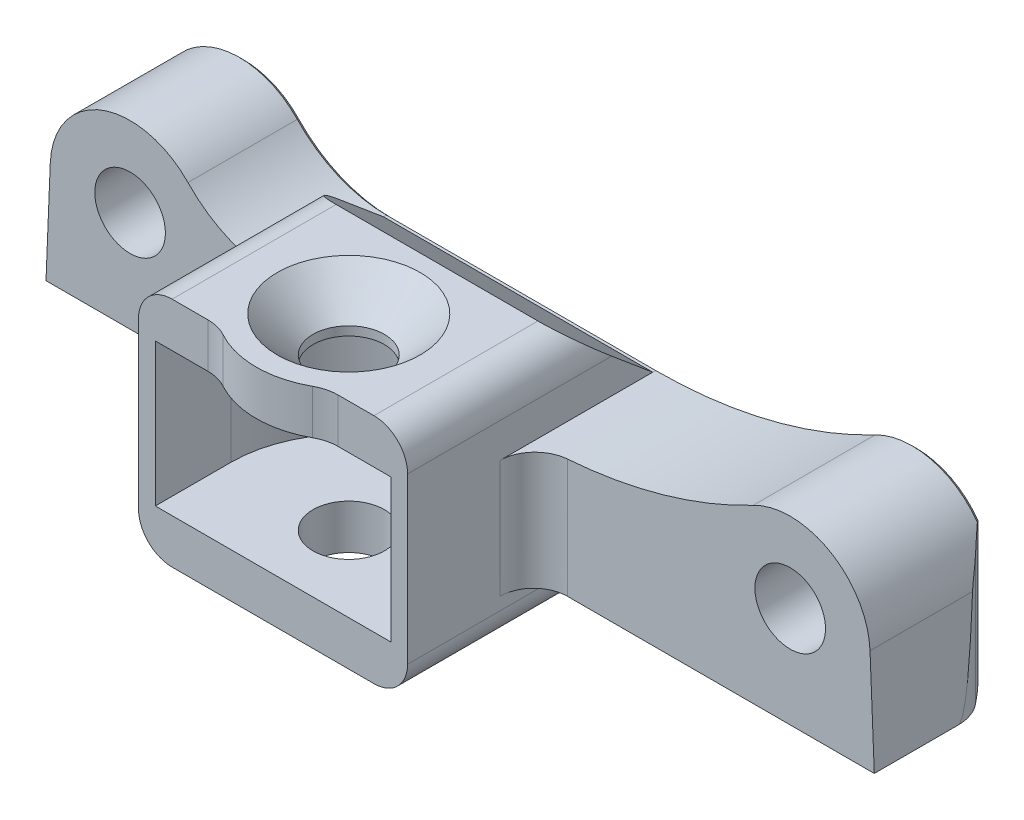
from build123d import *

# Parameters (mm, degrees)
BOSS_EXTRUDE1_DEPTH                             = 16
SKETCH2_R                                       = 4.25
CUT_EXTRUDE1_DEPTH                              = 44.792236755
CUT_EXTRUDE2_START                              = -5.3
CUT_EXTRUDE2_DEPTH                              = 17
CSK_FOR_M8_FLAT_HEAD_MACHINE_SCREW1_D           = 8
CSK_FOR_M8_FLAT_HEAD_MACHINE_SCREW1_CSINK_D     = 17
CSK_FOR_M8_FLAT_HEAD_MACHINE_SCREW1_CSINK_ANGLE = 90
SKETCH6_R                                       = 4.2
BOSS_EXTRUDE2_DEPTH                             = 15
SKETCH7_R                                       = 4.2
BOSS_EXTRUDE3_DEPTH                             = 4
SKETCH9_R                                       = 2.6
CUT_EXTRUDE3_DEPTH                              = 6
CUT_EXTRUDE4_START                              = -1.5
CUT_EXTRUDE4_DEPTH                              = 1.5
FILLET2_R                                       = 4
FILLET3_R                                       = 4
BOSS_EXTRUDE4_DEPTH                             = 5.3
FILLET4_R                                       = 5
CHAMFER1_SIZE                                   = 0.6
CUT_EXTRUDE5_DEPTH                              = 69.590524127
CHAMFER2_SIZE                                   = 0.5


with BuildPart() as part:
    # Sketch1 → Boss-Extrude1 (new, symmetric)
    with BuildSketch(Plane(origin=(0, 0, 0), x_dir=(0, 0, -1), z_dir=(1, 0, 0))):
        Polygon((0, 0), (0, 14), (-0.8467959, 14), (-10.5, 22.1), (-30, 22.1), (-30, -5.5), (-11.5, -5.5), (-4.945355241, 0), align=None)
    extrude(amount=BOSS_EXTRUDE1_DEPTH, both=True)

    # Sketch2 → Cut-Extrude1 (cut, through all)
    with BuildSketch(Plane(origin=(0, 22.1, 0), x_dir=(1, 0, 0), z_dir=(0, 1, 0))):
        with Locations(Location((0, -21, 0), (0, 0, 270))):
            Circle(SKETCH2_R)
    extrude(amount=-CUT_EXTRUDE1_DEPTH, mode=Mode.SUBTRACT)

    # Sketch3 → Cut-Extrude2 (cut)
    with BuildSketch(Plane(origin=(0, 22.1, 0), x_dir=(1, 0, 0), z_dir=(0, 1, 0)).offset(CUT_EXTRUDE2_START)):
        with BuildLine():
            Line((-14, -21), (-14, -59.082734499))
            Line((-14, -59.082734499), (14, -59.082734499))
            Line((14, -59.082734499), (14, -21))
            ThreePointArc((14, -21), (0, -7), (-14, -21))
        make_face()
    extrude(amount=-CUT_EXTRUDE2_DEPTH, mode=Mode.SUBTRACT)

    # CSK for M8 Flat Head Machine Screw1 (through all)
    with Locations(Plane(origin=(0, 22.1, 0), x_dir=(-1, 0, 0), z_dir=(0, 1, 0))):
        with Locations((0, 21)):
            CounterSinkHole(CSK_FOR_M8_FLAT_HEAD_MACHINE_SCREW1_D / 2, CSK_FOR_M8_FLAT_HEAD_MACHINE_SCREW1_CSINK_D / 2, counter_sink_angle=CSK_FOR_M8_FLAT_HEAD_MACHINE_SCREW1_CSINK_ANGLE)

    # Sketch6 → Boss-Extrude2 (add)
    # profile 1 of 2: a face of its own
    with BuildSketch(Plane(origin=(0, 0, 0), x_dir=(-1, 0, 0), z_dir=(0, 0, -1))):
        with BuildLine():
            Line((-16, 14), (-16, 0))
            Line((-16, 0), (-56.5, 0))
            Line((-56.5, 0), (-55.992024719, 12.389187266))
            ThreePointArc((-55.992024719, 12.389187266), (-51.251583122, 20.226327117), (-42.094272681, 20.41662443))
            ThreePointArc((-42.094272681, 20.41662443), (-29.435811623, 15.627699401), (-16, 14))
        make_face()
        with Locations((-46.5, 12)):
            Circle(SKETCH6_R, mode=Mode.SUBTRACT)
    # profile 2 of 2: a face of its own
    with BuildSketch(Plane(origin=(0, 0, 0), x_dir=(-1, 0, 0), z_dir=(0, 0, -1))):
        with BuildLine():
            Line((42.992024719, 12.389187266), (43.5, 0))
            Line((43.5, 0), (16, 0))
            Line((16, 0), (16, 14))
            ThreePointArc((16, 14), (21.777483046, 15.185872893), (26.620689655, 18.551724138))
            ThreePointArc((26.620689655, 18.551724138), (36.846757278, 20.890962587), (42.992024719, 12.389187266))
        make_face()
        with Locations((33.5, 12)):
            Circle(SKETCH6_R, mode=Mode.SUBTRACT)
    extrude(amount=-BOSS_EXTRUDE2_DEPTH)

    # Sketch7 → Boss-Extrude3 (add)
    with BuildSketch(Plane(origin=(0, 0, 0), x_dir=(-1, 0, 0), z_dir=(0, 0, -1))):
        with Locations((-46.5, 12)):
            Circle(SKETCH7_R)
        with Locations((33.5, 12)):
            Circle(SKETCH7_R)
    extrude(amount=-BOSS_EXTRUDE3_DEPTH)

    # Sketch9 → Cut-Extrude3 (cut)
    with BuildSketch(Plane.XZ):
        with Locations(Location((-38.5, 5, 0), (0, 0, 270))):
            Circle(SKETCH9_R)
        with Locations(Location((-25.5, 10, 0), (0, 0, 270))):
            Circle(SKETCH9_R)
        with Locations(Location((38.5, 10, 0), (0, 0, 270))):
            Circle(SKETCH9_R)
        with Locations(Location((51.5, 5, 0), (0, 0, 270))):
            Circle(SKETCH9_R)
    extrude(amount=-CUT_EXTRUDE3_DEPTH, mode=Mode.SUBTRACT)

    # Sketch11 → Cut-Extrude4 (cut)
    with BuildSketch(Plane.XY.offset(15).offset(CUT_EXTRUDE4_START)):
        with BuildLine():
            Line((-42.992024719, 12.389187266), (-43.5, 0))
            Line((-43.5, 0), (-16, 0))
            Line((-16, 0), (-16, 14))
            ThreePointArc((-16, 14), (-21.777483046, 15.185872893), (-26.620689655, 18.551724138))
            ThreePointArc((-26.620689655, 18.551724138), (-36.846757278, 20.890962587), (-42.992024719, 12.389187266))
        make_face()
    extrude(amount=CUT_EXTRUDE4_DEPTH, mode=Mode.SUBTRACT)

    # Fillet2
    fillet2_edges = [part.edges().sort_by_distance(p)[0] for p in [
        (-16, 7, 13.5),
        (16, 7, 15),
    ]]
    fillet(fillet2_edges, radius=FILLET2_R)

    # Fillet3
    fillet3_edges = [part.edges().sort_by_distance(p)[0] for p in [
        (16, -5.5, 20.75),
        (-16, -5.5, 20.75),
        (-16, 22.1, 20.25),
        (16, 22.1, 20.25),
    ]]
    fillet(fillet3_edges, radius=FILLET3_R)

    # Sketch10 → Boss-Extrude4 (add)
    with BuildSketch(Plane(origin=(0, 22.1, 0), x_dir=(1, 0, 0), z_dir=(0, 1, 0))):
        with BuildLine():
            Line((6.32455532, -30), (-6.32455532, -30))
            ThreePointArc((-6.32455532, -30), (0, -32), (6.32455532, -30))
        make_face()
    extrude(amount=-BOSS_EXTRUDE4_DEPTH)

    # Fillet4
    fillet4_edges = [part.edges().sort_by_distance(p)[0] for p in [
        (6.32455532, 19.45, 30),
        (-6.32455532, 19.45, 30),
    ]]
    fillet(fillet4_edges, radius=FILLET4_R)

    # Chamfer1
    chamfer1_edges = [part.edges().sort_by_distance(p)[0] for p in [
        (-38.5, 0, 7.6),
        (-25.5, 0, 12.6),
        (38.5, 0, 12.6),
        (51.5, 0, 7.6),
    ]]
    chamfer(chamfer1_edges, length=CHAMFER1_SIZE)

    # Sketch12 → Cut-Extrude5 (cut, through all)
    with BuildSketch(Plane.XZ):
        with BuildLine():
            Line((-42.330222216, 1.786061952), (-40.831538291, 0))
            Line((-40.831538291, 0), (-43.5, 0))
            Line((-43.5, 0), (-43.5, 5))
            ThreePointArc((-43.5, 5), (-43.198463104, 3.289899283), (-42.330222216, 1.786061952))
        make_face()
        with BuildLine():
            Line((55.330222216, 1.786061952), (53.831538291, 0))
            Line((53.831538291, 0), (56.5, 0))
            Line((56.5, 0), (56.5, 5))
            ThreePointArc((56.5, 5), (56.198463104, 3.289899283), (55.330222216, 1.786061952))
        make_face()
    extrude(amount=-CUT_EXTRUDE5_DEPTH, mode=Mode.SUBTRACT)

    # Chamfer2
    chamfer2_edges = [part.edges().sort_by_distance(p)[0] for p in [
        (-33.840931852, 21.493880422, 0),
        (-21.777483046, 15.185872893, 0),
        (0, 14, 0),
        (29.435811623, 15.627699401, 0),
        (48.384280249, 21.311255981, 0),
        (6.5, 0, 0),
    ]]
    chamfer(chamfer2_edges, length=CHAMFER2_SIZE)


solid = part.part
